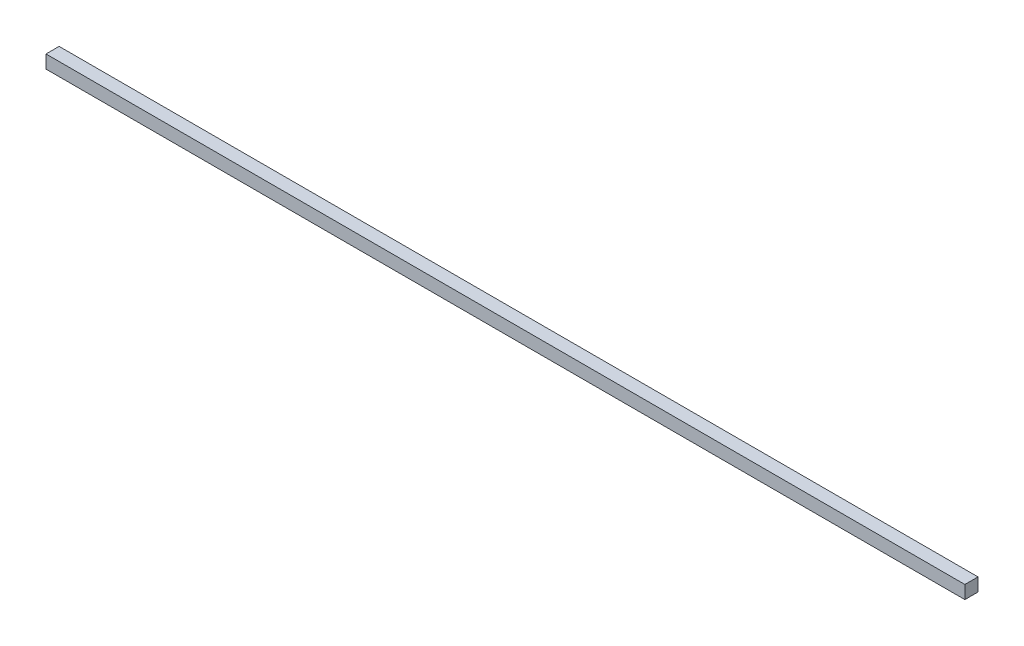
from build123d import *

# Parameters (mm, degrees)
SKETCH1_W           = 6
SKETCH1_H           = 420
BOSS_EXTRUDE1_DEPTH = 6


with BuildPart() as part:
    # Sketch1 → Boss-Extrude1 (new body)
    with BuildSketch(Plane(origin=(0, 0, 0), x_dir=(0, 1, 0), z_dir=(0, 0, 1))):
        with Locations((-65.237529691, -19.300475059)):
            Rectangle(SKETCH1_W, SKETCH1_H)
    extrude(amount=BOSS_EXTRUDE1_DEPTH)


solid = part.part
